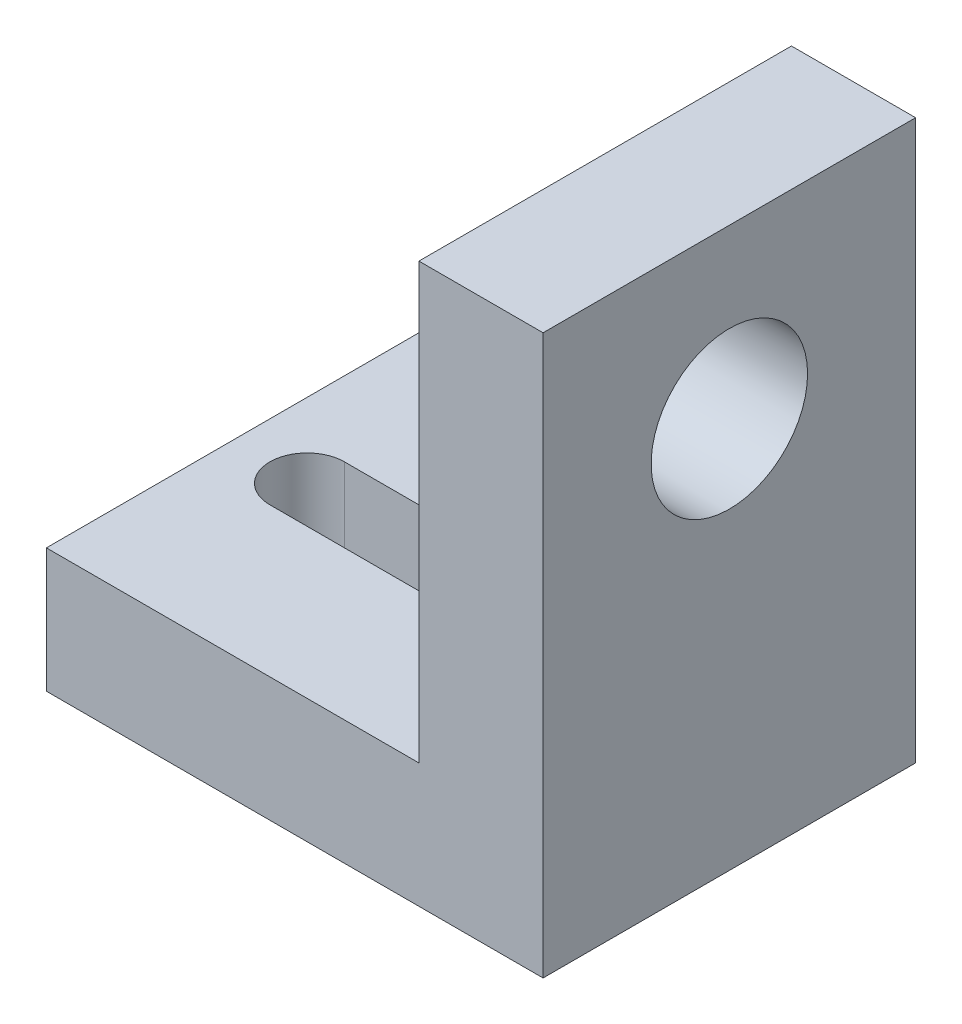
from build123d import *

# Parameters (mm, degrees)
CROQUIS1_W              = 20
CROQUIS1_H              = 15
SALIENTE_EXTRUIR1_DEPTH = 5
CROQUIS2_W              = 5
CROQUIS2_H              = 15
SALIENTE_EXTRUIR2_DEPTH = 21.5
CROQUIS3_R              = 3.15
CORTAR_EXTRUIR1_DEPTH   = 20
CORTAR_EXTRUIR2_DEPTH   = 20
CROQUIS7_R              = 4
SALIENTE_EXTRUIR3_DEPTH = 0.2
CROQUIS8_W              = 15
CROQUIS8_H              = 4
CORTAR_EXTRUIR3_DEPTH   = 10


with BuildPart() as part:
    # Croquis1 → Saliente-Extruir1 (new body)
    with BuildSketch(Plane(origin=(0, 0, 0), x_dir=(1, 0, 0), z_dir=(0, 1, 0))):
        Rectangle(CROQUIS1_W, CROQUIS1_H)
    extrude(amount=SALIENTE_EXTRUIR1_DEPTH)

    # Croquis2 → Saliente-Extruir2 (add)
    with BuildSketch(Plane(origin=(0, 5, 0), x_dir=(1, 0, 0), z_dir=(0, 1, 0))):
        with Locations((7.5, 0)):
            Rectangle(CROQUIS2_W, CROQUIS2_H)
    extrude(amount=SALIENTE_EXTRUIR2_DEPTH)

    # Croquis3 → Cortar-Extruir1 (cut)
    with BuildSketch(Plane(origin=(10, 0, 0), x_dir=(0, 0, -1), z_dir=(1, 0, 0))):
        with Locations((0, 15.75)):
            Circle(CROQUIS3_R)
    extrude(amount=-CORTAR_EXTRUIR1_DEPTH, mode=Mode.SUBTRACT)

    # Croquis4 → Cortar-Extruir2 (cut)
    with BuildSketch(Plane(origin=(0, 5, 0), x_dir=(1, 0, 0), z_dir=(0, 1, 0))):
        with BuildLine():
            Line((-7, 1.5), (2, 1.5))
            ThreePointArc((2, 1.5), (3.5, 0), (2, -1.5))
            Line((2, -1.5), (-7, -1.5))
            ThreePointArc((-7, -1.5), (-8.5, 0), (-7, 1.5))
        make_face()
    extrude(amount=-CORTAR_EXTRUIR2_DEPTH, mode=Mode.SUBTRACT)

    # Croquis7 → Saliente-Extruir3 (add)
    with BuildSketch(Plane.ZY.offset(-5)):
        with Locations((0, 15.75)):
            Circle(CROQUIS7_R)
    extrude(amount=-SALIENTE_EXTRUIR3_DEPTH)

    # Croquis8 → Cortar-Extruir3 (cut)
    with BuildSketch(Plane(origin=(10, 0, 0), x_dir=(0, 0, -1), z_dir=(1, 0, 0))):
        with Locations((0, 24.5)):
            Rectangle(CROQUIS8_W, CROQUIS8_H)
    extrude(amount=-CORTAR_EXTRUIR3_DEPTH, mode=Mode.SUBTRACT)


solid = part.part
